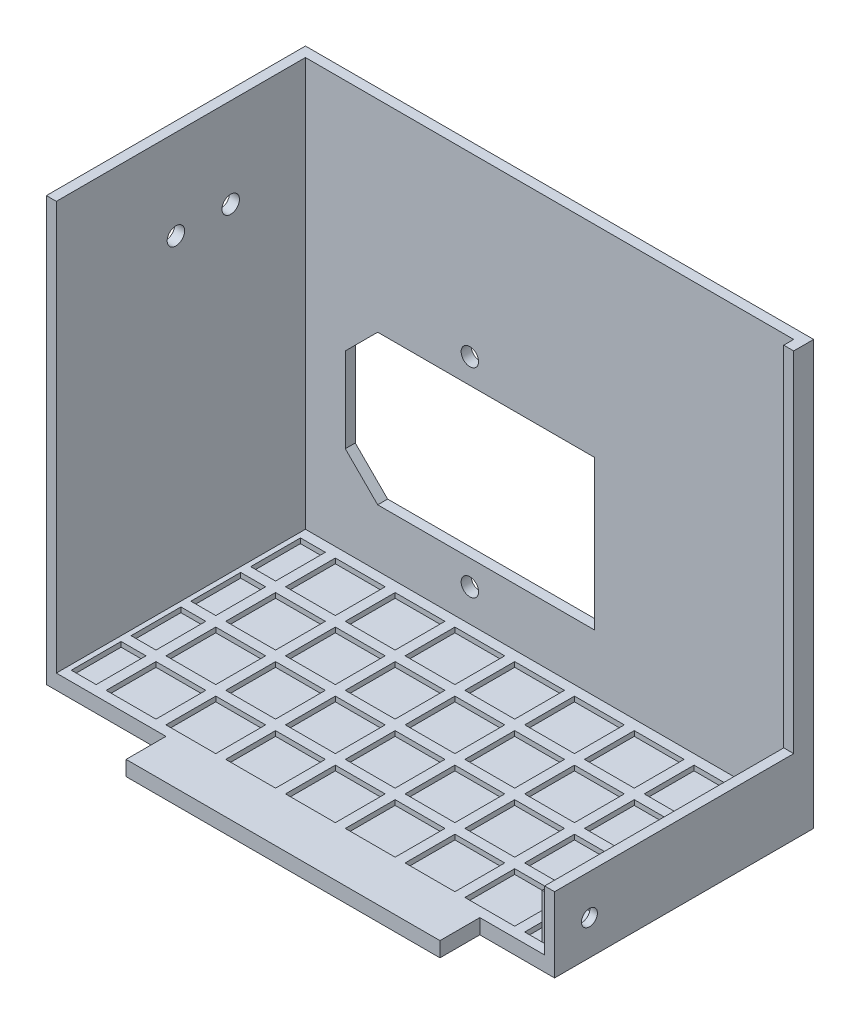
from build123d import *

# Parameters (mm, degrees)
SKETCH1_W           = 102
SKETCH1_H           = 52
SKETCH1_W_2         = 63
SKETCH1_H_2         = 8
BOSS_EXTRUDE1_DEPTH = 3
BOSS_EXTRUDE2_DEPTH = 82
SKETCH3_W           = 2
SKETCH3_H           = 48
BOSS_EXTRUDE3_DEPTH = 12
CUT_EXTRUDE1_REACH  = 144.594
SKETCH4_R           = 1.6
SKETCH5_W           = 10
SKETCH5_H           = 10
SKETCH5_W_2         = 5
SKETCH5_W_3         = 4
CUT_EXTRUDE2_DEPTH  = 1
SKETCH6_W           = 10
SKETCH6_H           = 10
SKETCH6_R           = 1.6
BOSS_EXTRUDE4_DEPTH = 4.5
CUT_EXTRUDE3_DEPTH  = 3
SKETCH8_R           = 1.75
CUT_EXTRUDE4_DEPTH  = 3
SKETCH9_R           = 1.75
CUT_EXTRUDE5_DEPTH  = 3


with BuildPart() as part:
    # Sketch1 → Boss-Extrude1 (new body)
    with BuildSketch(Plane(origin=(0, 0, 0), x_dir=(1, 0, 0), z_dir=(0, 1, 0))):
        with Locations((51, 26)):
            Rectangle(SKETCH1_W, SKETCH1_H)
        with Locations((55.5, -4)):
            Rectangle(SKETCH1_W_2, SKETCH1_H_2)
    extrude(amount=BOSS_EXTRUDE1_DEPTH)

    # Sketch2 → Boss-Extrude2 (add)
    with BuildSketch(Plane(origin=(0, 3, 0), x_dir=(1, 0, 0), z_dir=(0, 1, 0))):
        Polygon((0, 0), (0, 52), (102, 52), (102, 48), (100, 48), (100, 50), (2, 50), (2, 0), align=None)
    extrude(amount=BOSS_EXTRUDE2_DEPTH)

    # Sketch3 → Boss-Extrude3 (add)
    with BuildSketch(Plane(origin=(0, 3, 0), x_dir=(1, 0, 0), z_dir=(0, 1, 0))):
        with Locations((101, 24)):
            Rectangle(SKETCH3_W, SKETCH3_H)
    extrude(amount=BOSS_EXTRUDE3_DEPTH)

    # Sketch4 → Cut-Extrude1 (cut, up to next)
    with BuildSketch(Plane(origin=(102, 0, 0), x_dir=(0, 0, -1), z_dir=(1, 0, 0)), mode=Mode.PRIVATE) as cut_extrude1_sk1:
        with Locations((7, 7)):
            Circle(SKETCH4_R)
    cut_extrude1_tool1 = extrude(cut_extrude1_sk1.sketch, amount=-CUT_EXTRUDE1_REACH, mode=Mode.PRIVATE) & part.part
    add(cut_extrude1_tool1.solids().sort_by_distance((102, 7, -7))[0], mode=Mode.SUBTRACT)

    # Sketch5 → Cut-Extrude2 (cut)
    with BuildSketch(Plane(origin=(0, 3, 0), x_dir=(1, 0, 0), z_dir=(0, 1, 0))):
        with Locations((87, 7)):
            Rectangle(SKETCH5_W, SKETCH5_H)
        with Locations((75, 7)):
            Rectangle(SKETCH5_W, SKETCH5_H)
        with Locations((63, 7)):
            Rectangle(SKETCH5_W, SKETCH5_H)
        with Locations((51, 7)):
            Rectangle(SKETCH5_W, SKETCH5_H)
        with Locations((39, 7)):
            Rectangle(SKETCH5_W, SKETCH5_H)
        with Locations((27, 7)):
            Rectangle(SKETCH5_W, SKETCH5_H)
        with Locations((15, 7)):
            Rectangle(SKETCH5_W, SKETCH5_H)
        with Locations((75, 19)):
            Rectangle(SKETCH5_W, SKETCH5_H)
        with Locations((63, 19)):
            Rectangle(SKETCH5_W, SKETCH5_H)
        with Locations((51, 19)):
            Rectangle(SKETCH5_W, SKETCH5_H)
        with Locations((39, 19)):
            Rectangle(SKETCH5_W, SKETCH5_H)
        with Locations((27, 19)):
            Rectangle(SKETCH5_W, SKETCH5_H)
        with Locations((15, 19)):
            Rectangle(SKETCH5_W, SKETCH5_H)
        with Locations((75, 31)):
            Rectangle(SKETCH5_W, SKETCH5_H)
        with Locations((63, 31)):
            Rectangle(SKETCH5_W, SKETCH5_H)
        with Locations((51, 31)):
            Rectangle(SKETCH5_W, SKETCH5_H)
        with Locations((39, 31)):
            Rectangle(SKETCH5_W, SKETCH5_H)
        with Locations((27, 31)):
            Rectangle(SKETCH5_W, SKETCH5_H)
        with Locations((15, 31)):
            Rectangle(SKETCH5_W, SKETCH5_H)
        with Locations((75, 43)):
            Rectangle(SKETCH5_W, SKETCH5_H)
        with Locations((63, 43)):
            Rectangle(SKETCH5_W, SKETCH5_H)
        with Locations((51, 43)):
            Rectangle(SKETCH5_W, SKETCH5_H)
        with Locations((39, 43)):
            Rectangle(SKETCH5_W, SKETCH5_H)
        with Locations((27, 43)):
            Rectangle(SKETCH5_W, SKETCH5_H)
        with Locations((15, 43)):
            Rectangle(SKETCH5_W, SKETCH5_H)
        with Locations((87, 19)):
            Rectangle(SKETCH5_W, SKETCH5_H)
        with Locations((87, 31)):
            Rectangle(SKETCH5_W, SKETCH5_H)
        with Locations((87, 43)):
            Rectangle(SKETCH5_W, SKETCH5_H)
        with Locations((5.5, 7)):
            Rectangle(SKETCH5_W_2, SKETCH5_H)
        with Locations((5.5, 19)):
            Rectangle(SKETCH5_W_2, SKETCH5_H)
        with Locations((5.5, 31)):
            Rectangle(SKETCH5_W_2, SKETCH5_H)
        with Locations((5.5, 43)):
            Rectangle(SKETCH5_W_2, SKETCH5_H)
        with Locations((96, 43)):
            Rectangle(SKETCH5_W_3, SKETCH5_H)
        with Locations((96, 31)):
            Rectangle(SKETCH5_W_3, SKETCH5_H)
        with Locations((96, 19)):
            Rectangle(SKETCH5_W_3, SKETCH5_H)
        with Locations((96, 7)):
            Rectangle(SKETCH5_W_3, SKETCH5_H)
    extrude(amount=-CUT_EXTRUDE2_DEPTH, mode=Mode.SUBTRACT)

    # Sketch6 → Boss-Extrude4 (add)
    with BuildSketch(Plane(origin=(102, 0, 0), x_dir=(0, 0, -1), z_dir=(1, 0, 0))):
        with Locations((7, 7)):
            Rectangle(SKETCH6_W, SKETCH6_H)
        with Locations((7, 7)):
            Circle(SKETCH6_R, mode=Mode.SUBTRACT)
    extrude(amount=-BOSS_EXTRUDE4_DEPTH)

    # Sketch7 → Cut-Extrude3 (cut)
    with BuildSketch(Plane.ZY.offset(-97.5)):
        Polygon((-4.250369343, 8.5875), (-7, 10.175), (-9.749630657, 8.5875), (-9.749630657, 5.4125), (-7, 3.825), (-4.250369343, 5.4125), align=None)
    extrude(amount=-CUT_EXTRUDE3_DEPTH, mode=Mode.SUBTRACT)

    # Sketch8 → Cut-Extrude4 (cut)
    with BuildSketch(Plane(origin=(0, 0, -52), x_dir=(-1, 0, 0), z_dir=(0, 0, -1))):
        with Locations((-35, 49.5)):
            Circle(SKETCH8_R)
        with Locations((-35, 9.5)):
            Circle(SKETCH8_R)
        Polygon((-16.5, 14.5), (-60, 14.5), (-60, 44.5), (-16.5, 44.5), (-10, 38), (-10, 21), align=None)
    extrude(amount=-CUT_EXTRUDE4_DEPTH, mode=Mode.SUBTRACT)

    # Sketch9 → Cut-Extrude5 (cut)
    with BuildSketch(Plane.ZY):
        with Locations((-24, 67)):
            Circle(SKETCH9_R)
        with Locations((-35, 67)):
            Circle(SKETCH9_R)
    extrude(amount=-CUT_EXTRUDE5_DEPTH, mode=Mode.SUBTRACT)


solid = part.part
